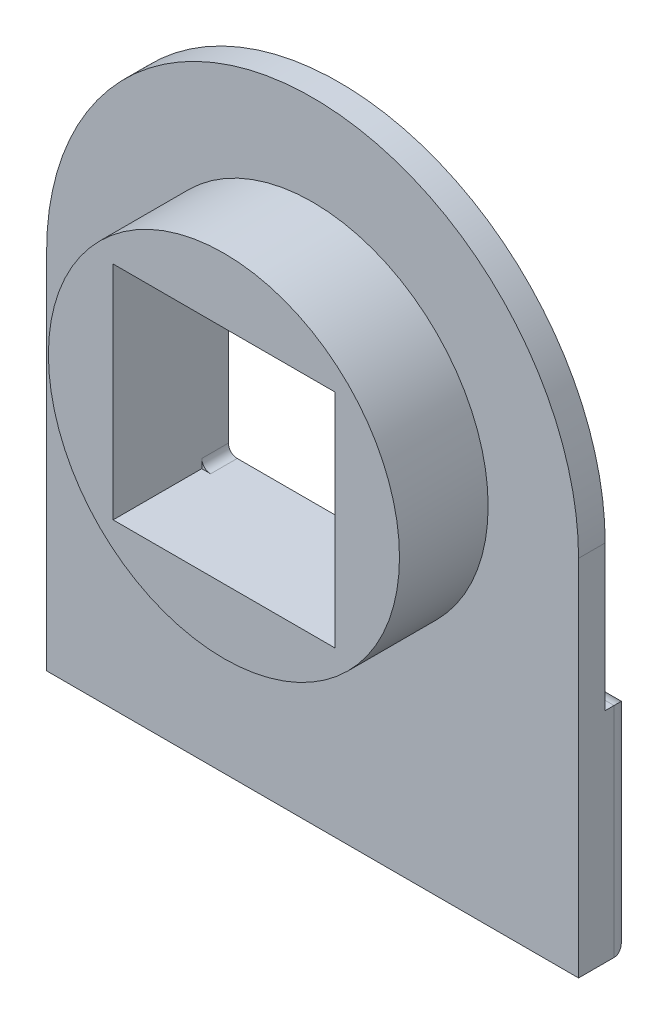
from build123d import *

# Parameters (mm, degrees)
SKETCH_1_R               = 19.8
EXTRUDE_1_DEPTH          = 13
SKETCH_2_R               = 19.8
EXTRUDE_2_DEPTH          = 3
SKETCH_3_W               = 60
SKETCH_3_H               = 24.618420452
EXTRUDE_3_DEPTH          = 3
FILLET_1_R               = 2
CUT_EXTRUDE_1_DEPTH      = 10
CUT_EXTRUDE_1_DEPTH_BACK = 10
SKETCH_4_R               = 1.821717012


with BuildPart() as part:
    # 草图1 → 凸台-拉伸1 (new body)
    with BuildSketch(Plane.XY):
        with Locations(Location((0, 0, 0), (0, 0, 180))):
            Circle(SKETCH_1_R)
        Polygon((0, -12.5), (12.5, -12.5), (12.5, 12.5), (0, 12.5), (-12.5, 12.5), (-12.5, -12.5), align=None, mode=Mode.SUBTRACT)
    extrude(amount=EXTRUDE_1_DEPTH)

    # 草图2 → 凸台-拉伸2 (add)
    # profile 1 of 5: a face of its own
    with BuildSketch(Plane(origin=(0, 0, 0), x_dir=(-1, 0, 0), z_dir=(0, 0, -1))):
        with BuildLine():
            ThreePointArc((30, 0), (0, 30), (-30, 0))
            Line((-30, 0), (-30, -41))
            Line((-30, -41), (30, -41))
            Line((30, -41), (30, 0))
        make_face()
        Circle(SKETCH_2_R, mode=Mode.SUBTRACT)
    # profile 2 of 5: a face of its own
    with BuildSketch(Plane(origin=(0, 0, 0), x_dir=(-1, 0, 0), z_dir=(0, 0, -1))):
        with BuildLine():
            Line((-12.5, 12.5), (-12.5, 11.5))
            ThreePointArc((-12.5, 11.5), (-12.207106781, 12.207106781), (-11.5, 12.5))
            Line((-11.5, 12.5), (-12.5, 12.5))
        make_face()
    # profile 3 of 5: a face of its own
    with BuildSketch(Plane(origin=(0, 0, 0), x_dir=(-1, 0, 0), z_dir=(0, 0, -1))):
        with BuildLine():
            ThreePointArc((12.5, -11.5), (12.207106781, -12.207106781), (11.5, -12.5))
            Line((11.5, -12.5), (12.5, -12.5))
            Line((12.5, -12.5), (12.5, -11.5))
        make_face()
    # profile 4 of 5: a face of its own
    with BuildSketch(Plane(origin=(0, 0, 0), x_dir=(-1, 0, 0), z_dir=(0, 0, -1))):
        with BuildLine():
            Line((-12.5, -12.5), (-11.5, -12.5))
            ThreePointArc((-11.5, -12.5), (-12.207106781, -12.207106781), (-12.5, -11.5))
            Line((-12.5, -11.5), (-12.5, -12.5))
        make_face()
    # profile 5 of 5: a face of its own
    with BuildSketch(Plane(origin=(0, 0, 0), x_dir=(-1, 0, 0), z_dir=(0, 0, -1))):
        with BuildLine():
            ThreePointArc((11.5, 12.5), (12.207106781, 12.207106781), (12.5, 11.5))
            Line((12.5, 11.5), (12.5, 12.5))
            Line((12.5, 12.5), (11.5, 12.5))
        make_face()
    extrude(amount=-EXTRUDE_2_DEPTH)

    # 草图3 → 凸台-拉伸3 (add)
    with BuildSketch(Plane(origin=(0, 0, 0), x_dir=(-1, 0, 0), z_dir=(0, 0, -1))):
        with Locations((0, -28.690789774)):
            Rectangle(SKETCH_3_W, SKETCH_3_H)
    extrude(amount=EXTRUDE_3_DEPTH)

    # 圆角1
    fillet_1_edges = [part.edges().sort_by_distance(p)[0] for p in [
        (30, -28.690789774, -3),
        (0, -41, -3),
        (-30, -28.690789774, -3),
        (0, -16.381579548, -3),
    ]]
    fillet(fillet_1_edges, radius=FILLET_1_R)

    # 草图4 → 切除-拉伸1 (cut, two sides: drawn at the far end of the back side and taken through both)
    with BuildSketch(Plane(origin=(0, 0, 0), x_dir=(-1, 0, 0), z_dir=(0, 0, -1)).offset(-CUT_EXTRUDE_1_DEPTH_BACK)):
        with Locations((20.33925745, -11.208047119)):
            Circle(SKETCH_4_R)
    extrude(amount=CUT_EXTRUDE_1_DEPTH + CUT_EXTRUDE_1_DEPTH_BACK, mode=Mode.SUBTRACT)


solid = part.part
